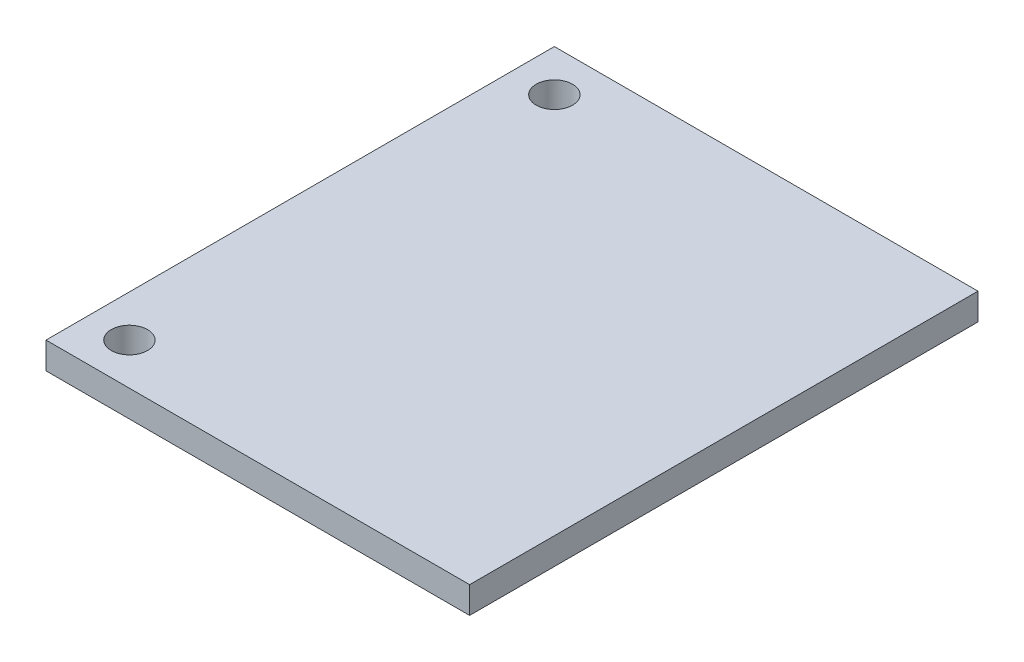
from build123d import *

# Parameters (mm, degrees)
SKETCH1_W           = 25.4
SKETCH1_H           = 30.48
BOSS_EXTRUDE1_DEPTH = 1.6
SKETCH2_R           = 1.09
CUT_EXTRUDE1_DEPTH  = 1.6


with BuildPart() as part:
    # Sketch1 → Boss-Extrude1 (new body)
    with BuildSketch(Plane(origin=(0, 0, 0), x_dir=(1, 0, 0), z_dir=(0, 1, 0))):
        Rectangle(SKETCH1_W, SKETCH1_H)
    extrude(amount=BOSS_EXTRUDE1_DEPTH)

    # Sketch2 → Cut-Extrude1 (cut)
    with BuildSketch(Plane(origin=(0, 1.6, 0), x_dir=(1, 0, 0), z_dir=(0, 1, 0))):
        with Locations(Location((-10.2, 12.74, 0), (0, 0, 270))):
            Circle(SKETCH2_R)
    cut_extrude1 = extrude(amount=-CUT_EXTRUDE1_DEPTH, mode=Mode.SUBTRACT)

    # Mirror1: Cut-Extrude1 across plane
    add(cut_extrude1.mirror(Plane.XY), mode=Mode.SUBTRACT)


solid = part.part
